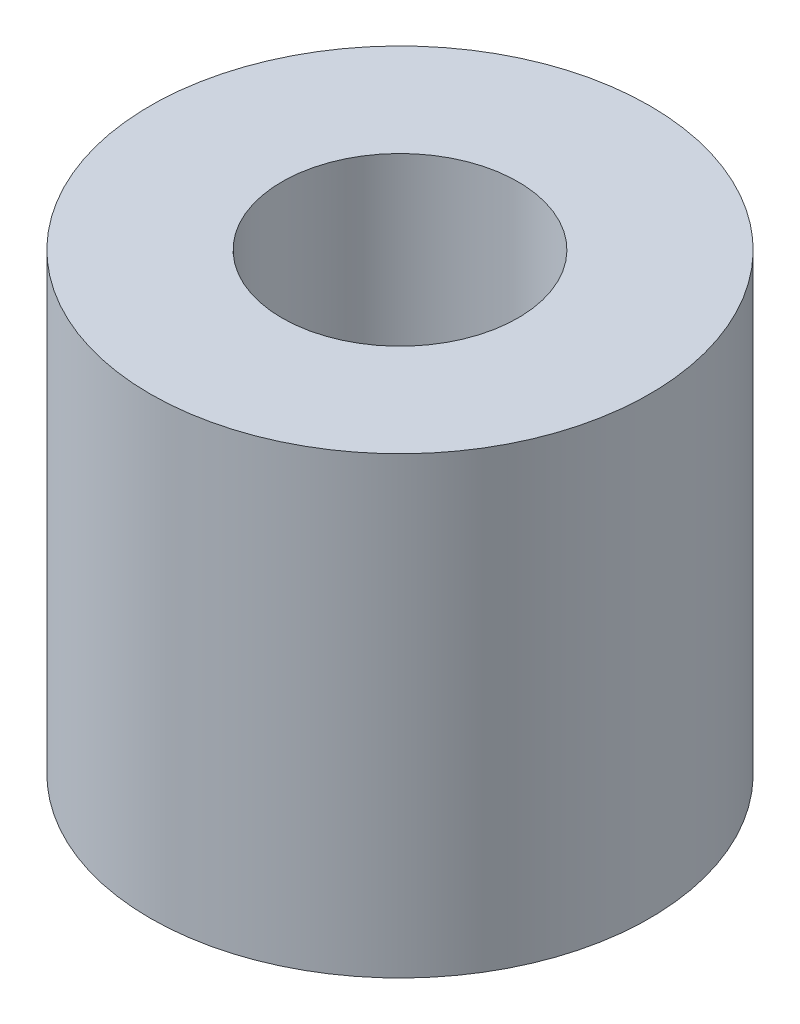
from build123d import *

# Parameters (mm, degrees)
SKETCH_1_R      = 5.5
SKETCH_1_R_2    = 2.6
EXTRUDE_1_DEPTH = 10


with BuildPart() as part:
    # 草图1 → 凸台-拉伸1 (new body)
    with BuildSketch(Plane(origin=(0, 0, 0), x_dir=(1, 0, 0), z_dir=(0, 1, 0))):
        with Locations(Location((0, 0, 0), (0, 0, 270))):
            Circle(SKETCH_1_R)
        with Locations(Location((0, 0, 0), (0, 0, 270))):
            Circle(SKETCH_1_R_2, mode=Mode.SUBTRACT)
    extrude(amount=EXTRUDE_1_DEPTH)


solid = part.part
